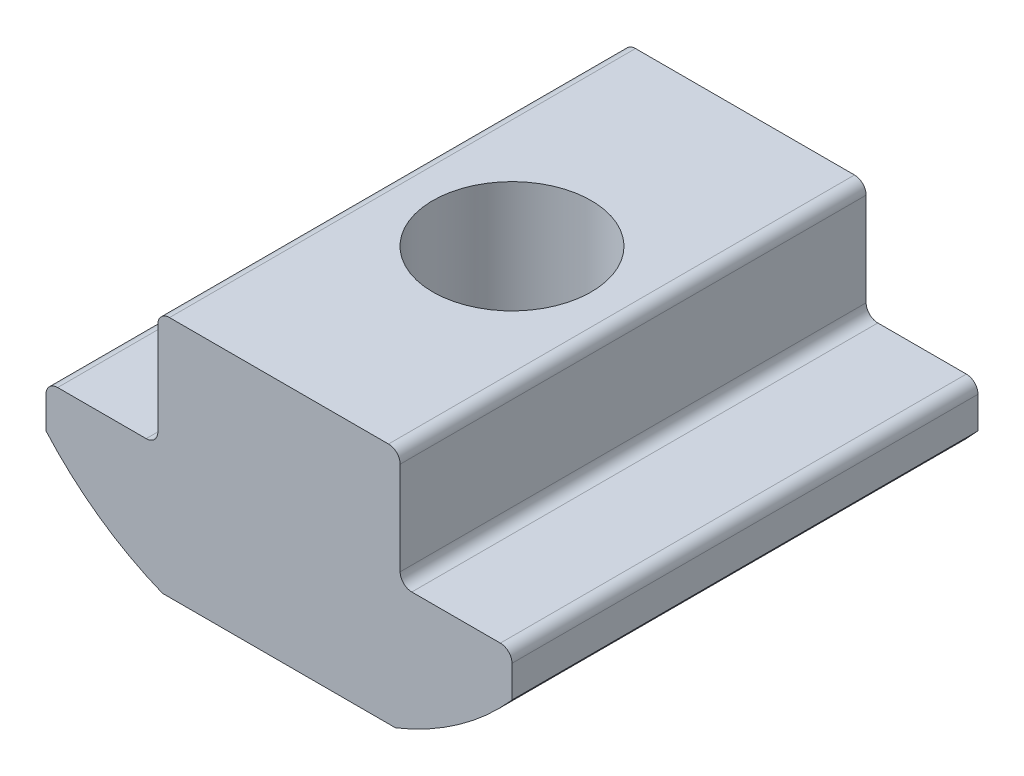
from build123d import *

# Parameters (mm, degrees)
EXTRUDE_1_DEPTH        = 10
HOLE_WIZARD_M8_1_D     = 6.8
HOLE_WIZARD_M8_1_DEPTH = 19.75
HOLE_WIZARD_M8_1_TIP   = 2.042926105


with BuildPart() as part:
    # 草图1 → 凸台-拉伸1 (new, symmetric)
    with BuildSketch(Plane.XY):
        with BuildLine():
            Line((-5, 0), (5, 0))
            ThreePointArc((5, 0), (7.707230765, 1.475471539), (10, 3.53686037))
            Line((10, 3.53686037), (10, 4.9))
            ThreePointArc((10, 4.9), (9.853553391, 5.253553391), (9.5, 5.4))
            Line((9.5, 5.4), (5.7, 5.4))
            ThreePointArc((5.7, 5.4), (5.346446609, 5.546446609), (5.2, 5.9))
            Line((5.2, 5.9), (5.2, 9.9))
            ThreePointArc((5.2, 9.9), (5.053553391, 10.253553391), (4.7, 10.4))
            Line((4.7, 10.4), (-4.7, 10.4))
            ThreePointArc((-4.7, 10.4), (-5.053553391, 10.253553391), (-5.2, 9.9))
            Line((-5.2, 9.9), (-5.2, 5.9))
            ThreePointArc((-5.2, 5.9), (-5.346446609, 5.546446609), (-5.7, 5.4))
            Line((-5.7, 5.4), (-9.5, 5.4))
            ThreePointArc((-9.5, 5.4), (-9.853553391, 5.253553391), (-10, 4.9))
            Line((-10, 4.9), (-10, 3.53686037))
            ThreePointArc((-10, 3.53686037), (-7.707230765, 1.475471539), (-5, 0))
        make_face()
    extrude(amount=EXTRUDE_1_DEPTH, both=True)

    # M8 螺纹孔1
    with Locations(Plane.ZX.offset(10.4)):
        with Locations((0, 0)):
            Hole(HOLE_WIZARD_M8_1_D / 2, depth=HOLE_WIZARD_M8_1_DEPTH)
            with Locations((0, 0, -(HOLE_WIZARD_M8_1_DEPTH + HOLE_WIZARD_M8_1_TIP / 2))):  # 118° drill point
                Cone(0, HOLE_WIZARD_M8_1_D / 2, HOLE_WIZARD_M8_1_TIP, mode=Mode.SUBTRACT)


solid = part.part
